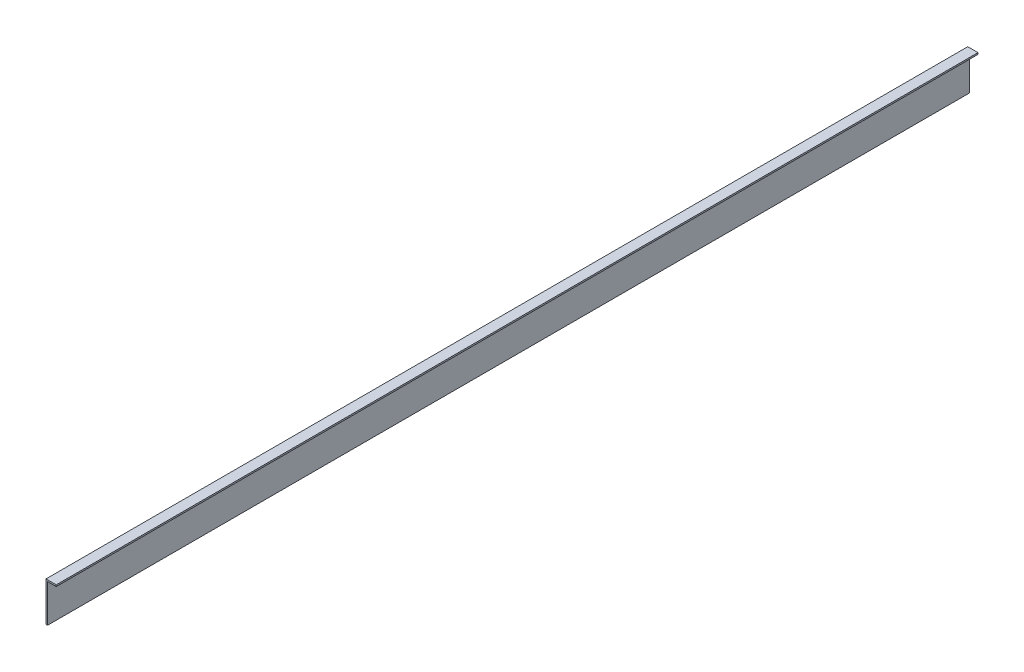
from build123d import *

# Parameters (mm, degrees)
BOSS_EXTRUDE1_DEPTH = 900


with BuildPart() as part:
    # Sketch1 → Boss-Extrude1 (new body)
    with BuildSketch(Plane.XY):
        Polygon((0, 0), (0, 38.5), (10, 38.5), (10, 37), (1.5, 37), (1.5, 0), align=None)
    extrude(amount=-BOSS_EXTRUDE1_DEPTH)


solid = part.part
